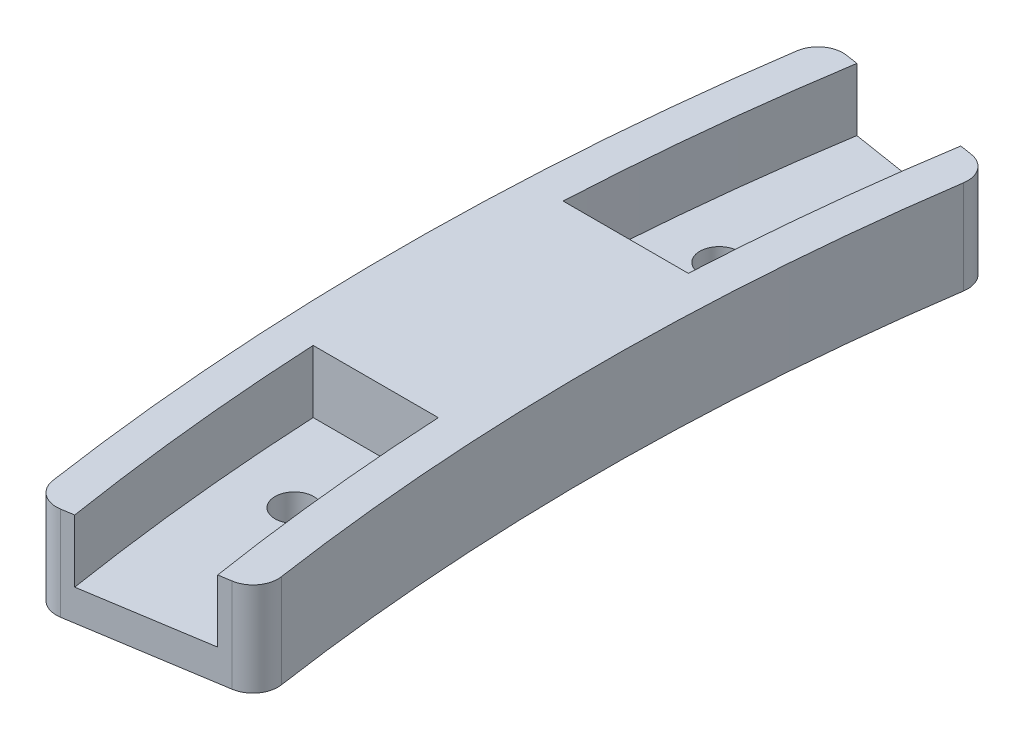
from build123d import *

# Parameters (mm, degrees)
BOSS_EXTRUDE1_DEPTH        = 10
CUT_EXTRUDE1_DEPTH         = 5
FILLET1_R                  = 2
CUT_EXTRUDE2_START         = -2.5
CUT_EXTRUDE2_DEPTH         = 2.5
F_3_1_3_1_DIAMETER_HOLE1_D = 3.1


with BuildPart() as part:
    # Sketch1 → Boss-Extrude1 (new body)
    with BuildSketch(Plane(origin=(0, 0, 0), x_dir=(1, 0, 0), z_dir=(0, 1, 0))):
        with BuildLine():
            ThreePointArc((-187.660784713, 29.722548358), (-190, 0), (-187.660784713, -29.722548358))
            Line((-187.660784713, -29.722548358), (-197.537668119, -31.286893008))
            ThreePointArc((-197.537668119, -31.286893008), (-200, 0), (-197.537668119, 31.286893008))
            Line((-197.537668119, 31.286893008), (-187.660784713, 29.722548358))
        make_face()
        with BuildLine():
            ThreePointArc((-197.537668119, -31.286893008), (-200, 0), (-197.537668119, 31.286893008))
            Line((-197.537668119, 31.286893008), (-200.500733141, 31.756196403))
            ThreePointArc((-200.500733141, 31.756196403), (-203, 0), (-200.500733141, -31.756196403))
            Line((-200.500733141, -31.756196403), (-197.537668119, -31.286893008))
        make_face()
        with BuildLine():
            Line((-184.697719691, 29.253244963), (-187.660784713, 29.722548358))
            ThreePointArc((-187.660784713, 29.722548358), (-190, 0), (-187.660784713, -29.722548358))
            Line((-187.660784713, -29.722548358), (-184.697719691, -29.253244963))
            ThreePointArc((-184.697719691, -29.253244963), (-187, 0), (-184.697719691, 29.253244963))
        make_face()
    extrude(amount=BOSS_EXTRUDE1_DEPTH)

    # Sketch15 → Cut-Extrude1 (cut)
    with BuildSketch(Plane(origin=(0, 10, 0), x_dir=(1, 0, 0), z_dir=(0, 1, 0))):
        with BuildLine():
            Line((-199.749843554, 10), (-189.73665961, 10))
            ThreePointArc((-189.73665961, 10), (-188.956218405, 19.88837666), (-187.660784713, 29.722548358))
            Line((-187.660784713, 29.722548358), (-197.537668119, 31.286893008))
            ThreePointArc((-197.537668119, 31.286893008), (-198.928692466, 20.673057674), (-199.749843554, 10))
        make_face()
        with BuildLine():
            ThreePointArc((-187.660784713, -29.722548358), (-188.956218405, -19.88837666), (-189.73665961, -10))
            Line((-189.73665961, -10), (-199.749843554, -10))
            ThreePointArc((-199.749843554, -10), (-198.928692466, -20.673057674), (-197.537668119, -31.286893008))
            Line((-197.537668119, -31.286893008), (-187.660784713, -29.722548358))
        make_face()
    extrude(amount=-CUT_EXTRUDE1_DEPTH, mode=Mode.SUBTRACT)

    # Fillet1
    fillet1_edges = [part.edges().sort_by_distance(p)[0] for p in [
        (-200.500733141, 5, 31.756196403),
        (-200.500733141, 5, -31.756196403),
        (-184.697719691, 5, -29.253244963),
        (-184.697719691, 5, 29.253244963),
    ]]
    fillet(fillet1_edges, radius=FILLET1_R)

    # Sketch19 → Cut-Extrude2 (cut)
    with BuildSketch(Plane.XZ.offset(CUT_EXTRUDE2_START)):
        with BuildLine():
            Line((-198.515528472, -31.441770873), (-186.662644351, -29.564458455))
            ThreePointArc((-186.662644351, -29.564458455), (-185.363721979, -28.773196969), (-184.996936421, -27.297133819))
            ThreePointArc((-184.996936421, -27.297133819), (-187, 0), (-184.996936421, 27.297133819))
            ThreePointArc((-184.996936421, 27.297133819), (-185.363721979, 28.773196969), (-186.662644351, 29.564458455))
            Line((-186.662644351, 29.564458455), (-198.515528472, 31.441770873))
            ThreePointArc((-198.515528472, 31.441770873), (-200.012003377, 31.078559473), (-200.806789416, 29.759592144))
            ThreePointArc((-200.806789416, 29.759592144), (-203, 0), (-200.806789416, -29.759592144))
            ThreePointArc((-200.806789416, -29.759592144), (-200.012003377, -31.078559473), (-198.515528472, -31.441770873))
        make_face()
    extrude(amount=CUT_EXTRUDE2_DEPTH, mode=Mode.SUBTRACT)

    # Ø3.1 (3.1) Diameter Hole1 (through all)
    with Locations(Plane(origin=(0, 2.5, 0), x_dir=(-1, 0, 0), z_dir=(0, -1, 0))):
        with Locations((194.257966128, 16.995369836), (194.257966128, -16.995369836)):
            Hole(F_3_1_3_1_DIAMETER_HOLE1_D / 2)


solid = part.part
